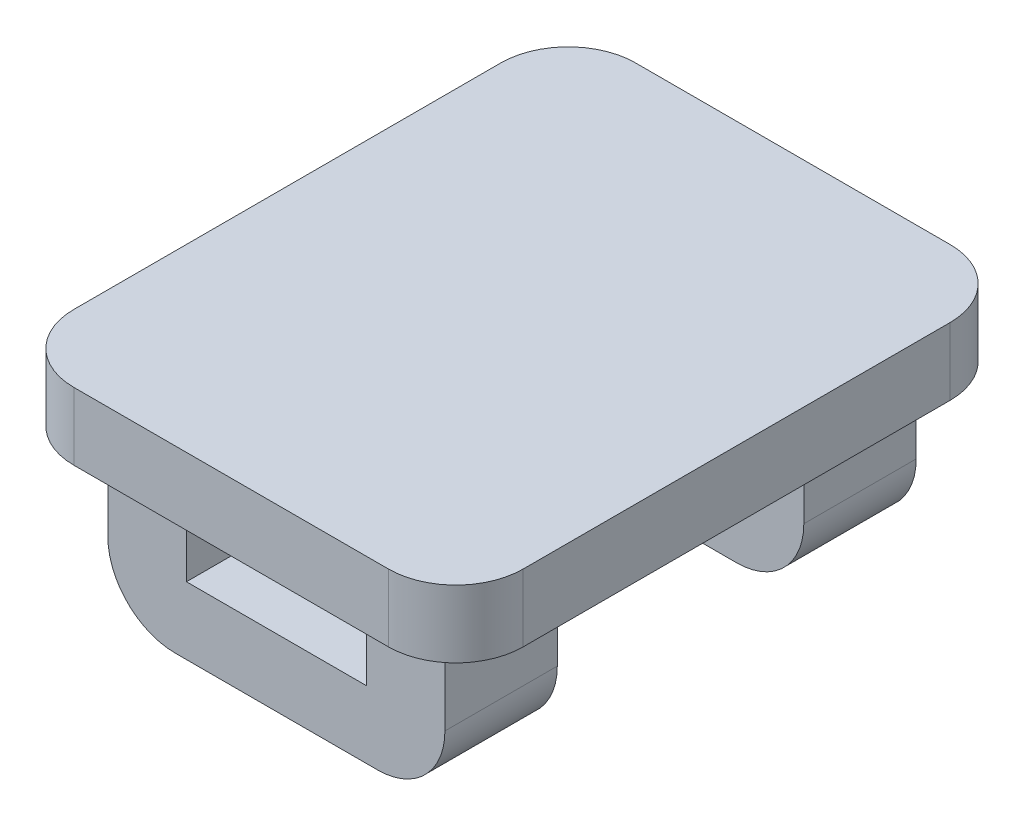
from build123d import *

# Parameters (mm, degrees)
ESBO_O1_W                = 20
ESBO_O1_H                = 25
RESSALTO_EXTRUS_O1_DEPTH = 3
ESBO_O2_W                = 15
ESBO_O2_H                = 5
RESSALTO_EXTRUS_O2_DEPTH = 7
FILETE3_R                = 3
ESBO_O4_W                = 8
ESBO_O4_H                = 3
CORTE_EXTRUS_O2_DEPTH    = 27.025134469
FILETE4_R                = 3


with BuildPart() as part:
    # Esboço1 → Ressalto-extrusão1 (new body)
    with BuildSketch(Plane(origin=(0, 0, 0), x_dir=(1, 0, 0), z_dir=(0, 1, 0))):
        Rectangle(ESBO_O1_W, ESBO_O1_H)
    extrude(amount=RESSALTO_EXTRUS_O1_DEPTH)

    # Esboço2 → Ressalto-extrusão2 (add)
    with BuildSketch(Plane(origin=(0, 0, 0), x_dir=(-1, 0, 0), z_dir=(0, -1, 0))):
        with Locations((0, 7.984943423)):
            Rectangle(ESBO_O2_W, ESBO_O2_H)
        with Locations((0, -7.984943423)):
            Rectangle(ESBO_O2_W, ESBO_O2_H)
    extrude(amount=RESSALTO_EXTRUS_O2_DEPTH)

    # Filete3
    filete3_edges = [part.edges().sort_by_distance(p)[0] for p in [
        (10, 1.5, 12.5),
        (-10, 1.5, 12.5),
        (-10, 1.5, -12.5),
        (10, 1.5, -12.5),
    ]]
    fillet(filete3_edges, radius=FILETE3_R)

    # Esboço4 → Corte-extrusão2 (cut, through all)
    with BuildSketch(Plane(origin=(0, 0, -10.484943423), x_dir=(-1, 0, 0), z_dir=(0, 0, -1))):
        with Locations((0, -2.5)):
            Rectangle(ESBO_O4_W, ESBO_O4_H)
    extrude(amount=-CORTE_EXTRUS_O2_DEPTH, mode=Mode.SUBTRACT)

    # Filete4
    filete4_edges = [part.edges().sort_by_distance(p)[0] for p in [
        (-7.5, -7, -7.984943423),
        (7.5, -7, -7.984943423),
        (7.5, -7, 7.984943423),
        (-7.5, -7, 7.984943423),
    ]]
    fillet(filete4_edges, radius=FILETE4_R)


solid = part.part
